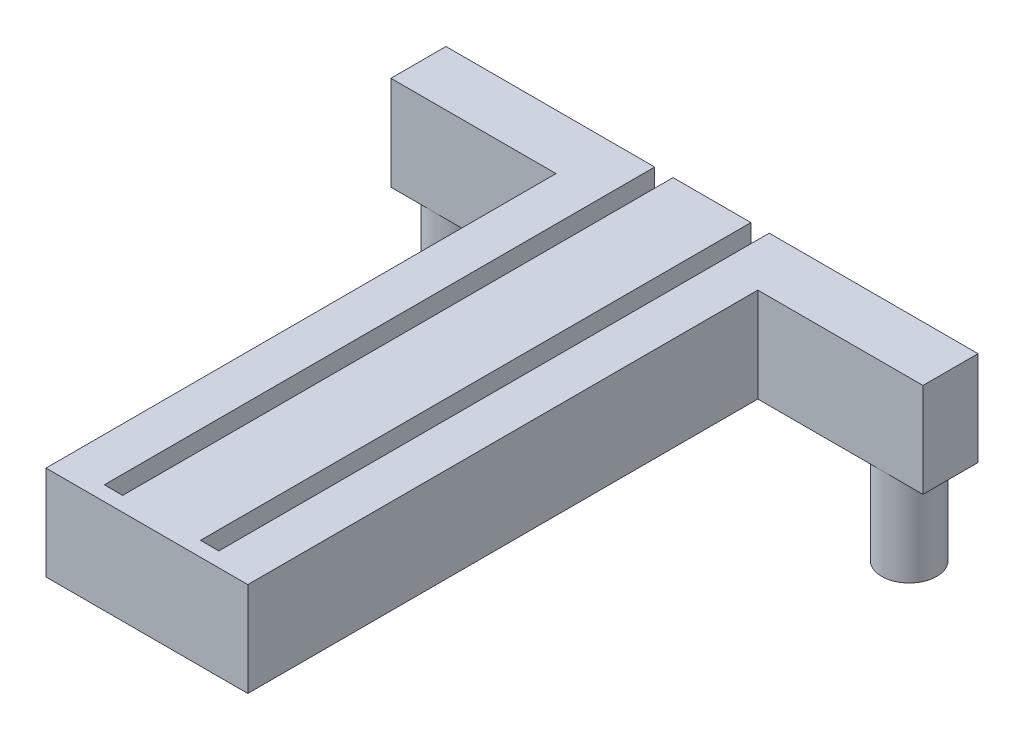
from build123d import *

# Parameters (mm, degrees)
BOSS_EXTRUDE1_DEPTH     = 76.2
SKETCH3_W               = 22.86
SKETCH3_H               = 68.58
CUT_EXTRUDE1_DEPTH      = 76.2
SKETCH4_W               = 27.94
SKETCH4_H               = 13.05965896
BOSS_EXTRUDE2_DEPTH     = 0.762
CUT_EXTRUDE2_DEPTH      = 99.822
SKETCH7_W               = 27.94
SKETCH7_H               = 13.05965896
BOSS_EXTRUDE3_DEPTH     = 1.27
SKETCH8_R               = 3.81
BOSS_EXTRUDE4_DEPTH     = 12.7
CUT_EXTRUDE3_DEPTH      = 116.55549125
CUT_EXTRUDE3_DEPTH_BACK = 116.55549125
SKETCH10_W              = 1.211973452
SKETCH10_H              = 6.241961148


with BuildPart() as part:
    # Sketch2 → Boss-Extrude1 (new body)
    with BuildSketch(Plane.XY):
        Polygon((-1.796051224, 1.796051224), (-5.388153673, 5.388153673), (-5.388153673, 10.468153673), (5.388153673, 10.468153673), (5.388153673, 5.388153673), (1.796051224, 1.796051224), (1.796051224, 0), (5.388153673, 0), (7.928153673, 0), (7.928153673, 10.468153673), (19.358153673, 10.468153673), (31.75, 10.468153673), (36.83, 10.468153673), (36.83, -2.591505287), (31.75, -2.591505287), (-31.75, -2.591505287), (-36.83, -2.591505287), (-36.83, 10.468153673), (-31.75, 10.468153673), (-19.358153673, 10.468153673), (-7.928153673, 10.468153673), (-7.928153673, 0), (-1.796051224, 0), align=None)
    extrude(amount=BOSS_EXTRUDE1_DEPTH)

    # Sketch3 → Cut-Extrude1 (cut)
    with BuildSketch(Plane(origin=(0, 10.468153673, 0), x_dir=(1, 0, 0), z_dir=(0, 1, 0))):
        with Locations((-25.4, -41.91)):
            Rectangle(SKETCH3_W, SKETCH3_H)
        with Locations((25.4, -41.91)):
            Rectangle(SKETCH3_W, SKETCH3_H)
    extrude(amount=-CUT_EXTRUDE1_DEPTH, mode=Mode.SUBTRACT)

    # Sketch4 → Boss-Extrude2 (add)
    with BuildSketch(Plane.XY.offset(76.2)):
        with Locations((0, 3.938324193)):
            Rectangle(SKETCH4_W, SKETCH4_H)
    extrude(amount=BOSS_EXTRUDE2_DEPTH)

    # Sketch5 → Cut-Extrude2 (cut)
    with BuildSketch(Plane.XY.offset(76.962)):
        Polygon((1.329001146, -2.591505287), (1.329001146, 0.714117771), (2.850653855, 0.714117771), (2.850653855, 1.492637762), (1.329001146, 1.492637762), (0, 1.492637762), (0, 0.714117771), (0, -2.591505287), align=None)
    extrude(amount=-CUT_EXTRUDE2_DEPTH, mode=Mode.SUBTRACT)

    # Sketch7 → Boss-Extrude3 (add)
    with BuildSketch(Plane.XY.offset(76.962)):
        with Locations((0, 3.938324193)):
            Rectangle(SKETCH7_W, SKETCH7_H)
    extrude(amount=BOSS_EXTRUDE3_DEPTH)

    # Sketch8 → Boss-Extrude4 (add)
    with BuildSketch(Plane.XZ.offset(2.591505287)):
        with Locations(Location((-31.115, 3.81, 0), (0, 0, 270))):
            Circle(SKETCH8_R)
        with Locations(Location((31.115, 3.81, 0), (0, 0, 270))):
            Circle(SKETCH8_R)
    extrude(amount=BOSS_EXTRUDE4_DEPTH)

    # Sketch10 → Cut-Extrude3 (cut, two sides: drawn at the far end of the back side and taken through both)
    with BuildSketch(Plane.ZY.offset(46.83).offset(-CUT_EXTRUDE3_DEPTH_BACK)):
        with Locations((0.605986726, -9.213101257)):
            Rectangle(SKETCH10_W, SKETCH10_H)
    extrude(amount=CUT_EXTRUDE3_DEPTH + CUT_EXTRUDE3_DEPTH_BACK, mode=Mode.SUBTRACT)


solid = part.part
